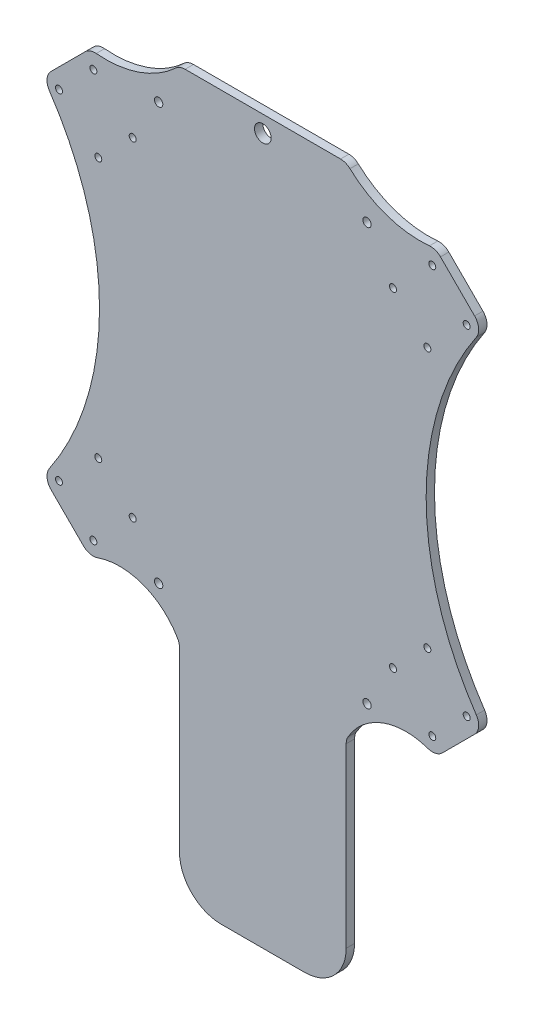
from build123d import *

# Parameters (mm, degrees)
SKETCH2_R           = 1.5
SKETCH2_R_2         = 3
BOSS_EXTRUDE1_DEPTH = 3
SKETCH3_R           = 1.25
F_45_DEGREES_DEPTH  = 188.565988388
FILLET1_R           = 5
FILLET2_R           = 5
FILLET3_R           = 5
FILLET4_R           = 5
FILLET5_R           = 5
FILLET6_R           = 5
FILLET7_R           = 5
FILLET8_R           = 5
FILLET10_R          = 5
FILLET11_R          = 5
FILLET12_R          = 5
FILLET13_R          = 5


with BuildPart() as part:
    # Sketch2 → Boss-Extrude1 (new body)
    with BuildSketch(Plane.XY):
        with BuildLine():
            Line((-79.195959493, 62.225396744), (-62.225396744, 79.195959493))
            ThreePointArc((-62.225396744, 79.195959493), (-44.806778225, 80.702789346), (-30, 90))
            Line((-30, 90), (30, 90))
            ThreePointArc((30, 90), (44.806778225, 80.702789346), (62.225396744, 79.195959493))
            Line((62.225396744, 79.195959493), (79.195959493, 62.225396744))
            ThreePointArc((79.195959493, 62.225396744), (58.781303002, 0), (79.195959493, -62.225396744))
            Line((79.195959493, -62.225396744), (62.225396744, -79.195959493))
            ThreePointArc((62.225396744, -79.195959493), (43.875108319, -77.923881554), (30, -90))
            Line((30, -90), (30, -155))
            ThreePointArc((30, -155), (25.606601718, -165.606601718), (15, -170))
            Line((15, -170), (-15, -170))
            ThreePointArc((-15, -170), (-25.606601718, -165.606601718), (-30, -155))
            Line((-30, -155), (-30, -90))
            ThreePointArc((-30, -90), (-43.875108319, -77.923881554), (-62.225396744, -79.195959493))
            Line((-62.225396744, -79.195959493), (-79.195959493, -62.225396744))
            ThreePointArc((-79.195959493, -62.225396744), (-58.781303002, 0), (-79.195959493, 62.225396744))
        make_face()
        with Locations((-37.5, 75)):
            Circle(SKETCH2_R, mode=Mode.SUBTRACT)
        with Locations((37.5, 75)):
            Circle(SKETCH2_R, mode=Mode.SUBTRACT)
        with Locations((37.5, -75)):
            Circle(SKETCH2_R, mode=Mode.SUBTRACT)
        with Locations((-37.5, -75)):
            Circle(SKETCH2_R, mode=Mode.SUBTRACT)
        with Locations((0, 84)):
            Circle(SKETCH2_R_2, mode=Mode.SUBTRACT)
    extrude(amount=BOSS_EXTRUDE1_DEPTH)

    # Sketch3 → 45 Degrees (cut, through all)
    with BuildSketch(Plane.XY.offset(3)):
        with Locations((-73.362328548, 60.987959877)):
            Circle(SKETCH3_R)
        with Locations((-59.220192924, 46.845824254)):
            Circle(SKETCH3_R)
        with Locations(Location((-60.987959877, 73.362328548, 0), (0, 0, 180))):
            Circle(SKETCH3_R)
        with Locations(Location((-46.845824254, 59.220192924, 0), (0, 0, 180))):
            Circle(SKETCH3_R)
        with Locations(Location((59.220192924, 46.845824254, 0), (0, 0, 180))):
            Circle(SKETCH3_R)
        with Locations(Location((73.362328548, 60.987959877, 0), (0, 0, 180))):
            Circle(SKETCH3_R)
        with Locations((60.987959877, 73.362328548)):
            Circle(SKETCH3_R)
        with Locations((46.845824254, 59.220192924)):
            Circle(SKETCH3_R)
        with Locations(Location((-59.220192924, -46.845824254, 0), (0, 0, 180))):
            Circle(SKETCH3_R)
        with Locations((-46.845824254, -59.220192924)):
            Circle(SKETCH3_R)
        with Locations((-60.987959877, -73.362328548)):
            Circle(SKETCH3_R)
        with Locations(Location((-73.362328548, -60.987959877, 0), (0, 0, 180))):
            Circle(SKETCH3_R)
        with Locations((59.220192924, -46.845824254)):
            Circle(SKETCH3_R)
        with Locations((73.362328548, -60.987959877)):
            Circle(SKETCH3_R)
        with Locations(Location((60.987959877, -73.362328548, 0), (0, 0, 180))):
            Circle(SKETCH3_R)
        with Locations(Location((46.845824254, -59.220192924, 0), (0, 0, 180))):
            Circle(SKETCH3_R)
    extrude(amount=-F_45_DEGREES_DEPTH, mode=Mode.SUBTRACT)

    # Fillet1
    fillet1_edges = [part.edges().sort_by_distance(p)[0] for p in [
        (-30, 90, 1.5),
    ]]
    fillet(fillet1_edges, radius=FILLET1_R)

    # Fillet2
    fillet2_edges = [part.edges().sort_by_distance(p)[0] for p in [
        (-79.195959493, 62.225396744, 1.5),
    ]]
    fillet(fillet2_edges, radius=FILLET2_R)

    # Fillet3
    fillet3_edges = [part.edges().sort_by_distance(p)[0] for p in [
        (-62.225396744, 79.195959493, 1.5),
    ]]
    fillet(fillet3_edges, radius=FILLET3_R)

    # Fillet4
    fillet4_edges = [part.edges().sort_by_distance(p)[0] for p in [
        (62.225396744, 79.195959493, 1.5),
    ]]
    fillet(fillet4_edges, radius=FILLET4_R)

    # Fillet5
    fillet5_edges = [part.edges().sort_by_distance(p)[0] for p in [
        (30, 90, 1.5),
    ]]
    fillet(fillet5_edges, radius=FILLET5_R)

    # Fillet6
    fillet6_edges = [part.edges().sort_by_distance(p)[0] for p in [
        (79.195959493, 62.225396744, 1.5),
    ]]
    fillet(fillet6_edges, radius=FILLET6_R)

    # Fillet7
    fillet7_edges = [part.edges().sort_by_distance(p)[0] for p in [
        (79.195959493, -62.225396744, 1.5),
    ]]
    fillet(fillet7_edges, radius=FILLET7_R)

    # Fillet8
    fillet8_edges = [part.edges().sort_by_distance(p)[0] for p in [
        (62.225396744, -79.195959493, 1.5),
    ]]
    fillet(fillet8_edges, radius=FILLET8_R)

    # Fillet10
    fillet10_edges = [part.edges().sort_by_distance(p)[0] for p in [
        (30, -90, 1.5),
    ]]
    fillet(fillet10_edges, radius=FILLET10_R)

    # Fillet11
    fillet11_edges = [part.edges().sort_by_distance(p)[0] for p in [
        (-30, -90, 1.5),
    ]]
    fillet(fillet11_edges, radius=FILLET11_R)

    # Fillet12
    fillet12_edges = [part.edges().sort_by_distance(p)[0] for p in [
        (-79.195959493, -62.225396744, 1.5),
    ]]
    fillet(fillet12_edges, radius=FILLET12_R)

    # Fillet13
    fillet13_edges = [part.edges().sort_by_distance(p)[0] for p in [
        (-62.225396744, -79.195959493, 1.5),
    ]]
    fillet(fillet13_edges, radius=FILLET13_R)


solid = part.part
